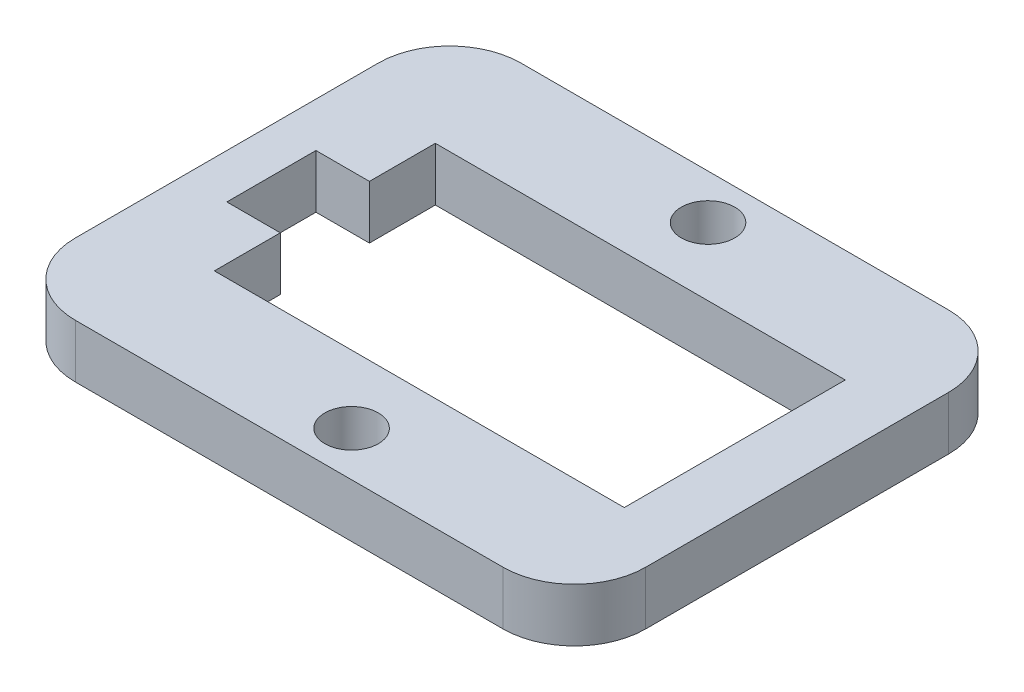
from build123d import *

# Parameters (mm, degrees)
ESBO_O1_W                  = 32
ESBO_O1_H                  = 25
RESSALTO_EXTRUS_O1_DEPTH   = 3
PERFIL_CORTE_W             = 23
PERFIL_CORTE_H             = 12.4
CORTE_PRINCIPAL_DEPTH      = 81.646945091
FURO_DE_DI_METRO_3_0_3_1_D = 3
ESBO_O6_W                  = 3
ESBO_O6_H                  = 5
CORTE_EXTRUS_O2_DEPTH      = 81.150651679
FILETE1_R                  = 4


with BuildPart() as part:
    # Esboço1 → Ressalto-extrusão1 (new body)
    with BuildSketch(Plane(origin=(0, 0, 0), x_dir=(1, 0, 0), z_dir=(0, 1, 0))):
        Rectangle(ESBO_O1_W, ESBO_O1_H)
    extrude(amount=RESSALTO_EXTRUS_O1_DEPTH)

    # Perfil Corte → Corte Principal (cut, through all)
    with BuildSketch(Plane(origin=(-56.229726339, 3, 23.246277925), x_dir=(1, 0, 0), z_dir=(0, 1, 0))):
        with Locations((57.229726339, 23.246277925)):
            Rectangle(PERFIL_CORTE_W, PERFIL_CORTE_H)
    extrude(amount=-CORTE_PRINCIPAL_DEPTH, mode=Mode.SUBTRACT)

    # Furo de diâmetro Ø3.0 (3)1 (through all)
    with Locations(Plane(origin=(-54.773419901, 3, 25), x_dir=(1, 0, 0), z_dir=(0, 1, 0))):
        with Locations((55.773419901, 35), (55.773419901, 15)):
            Hole(FURO_DE_DI_METRO_3_0_3_1_D / 2)

    # Esboço6 → Corte-extrusão2 (cut, through all)
    with BuildSketch(Plane(origin=(-54.773419901, 3, 25), x_dir=(1, 0, 0), z_dir=(0, 1, 0))):
        with Locations((42.773419901, 25)):
            Rectangle(ESBO_O6_W, ESBO_O6_H)
    extrude(amount=-CORTE_EXTRUS_O2_DEPTH, mode=Mode.SUBTRACT)

    # Filete1
    filete1_edges = [part.edges().sort_by_distance(p)[0] for p in [
        (16, 1.5, 12.5),
        (-16, 1.5, 12.5),
        (-16, 1.5, -12.5),
        (16, 1.5, -12.5),
    ]]
    fillet(filete1_edges, radius=FILETE1_R)


solid = part.part
